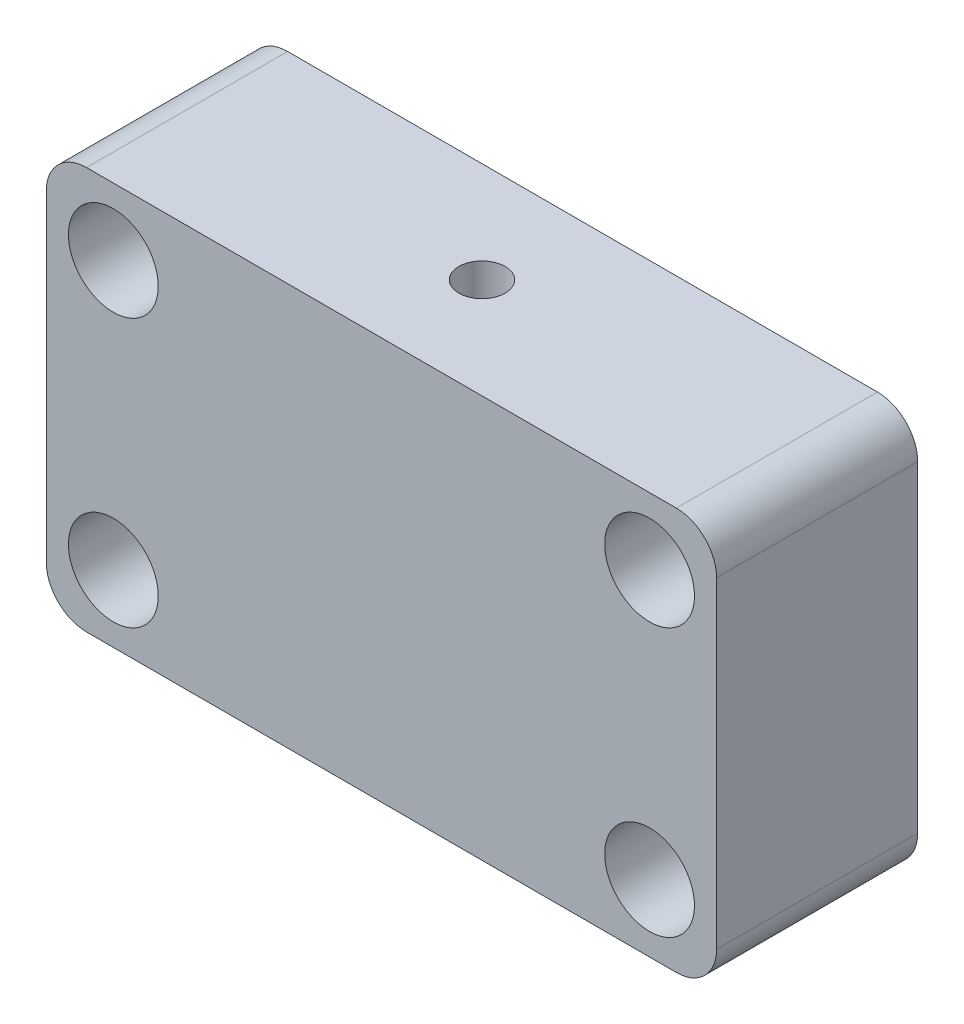
from build123d import *

# Parameters (mm, degrees)
SKETCH2_W                 = 50
SKETCH2_H                 = 30
SKETCH2_R                 = 3.35
BOSS_EXTRUDE1_DEPTH       = 15
F_8_32_TAPPED_HOLE1_D     = 3.4544
F_8_32_TAPPED_HOLE1_DEPTH = 5
F_8_32_TAPPED_HOLE1_TIP   = 1.037806461
FILLET1_R                 = 3
FILLET2_R                 = 3
FILLET3_R                 = 3
FILLET4_R                 = 3


with BuildPart() as part:
    # Sketch2 → Boss-Extrude1 (new body)
    with BuildSketch(Plane.XY):
        Rectangle(SKETCH2_W, SKETCH2_H)
        with Locations((20, 10)):
            Circle(SKETCH2_R, mode=Mode.SUBTRACT)
        with Locations((-20, 10)):
            Circle(SKETCH2_R, mode=Mode.SUBTRACT)
        with Locations((-20, -10)):
            Circle(SKETCH2_R, mode=Mode.SUBTRACT)
        with Locations((20, -10)):
            Circle(SKETCH2_R, mode=Mode.SUBTRACT)
    extrude(amount=BOSS_EXTRUDE1_DEPTH)

    # #8-32 Tapped Hole1
    with Locations(Plane(origin=(0, 15, 7.5), x_dir=(0, 0, 1), z_dir=(0, 1, 0))):
        with Locations((0, 0)):
            Hole(F_8_32_TAPPED_HOLE1_D / 2, depth=F_8_32_TAPPED_HOLE1_DEPTH)
            with Locations((0, 0, -(F_8_32_TAPPED_HOLE1_DEPTH + F_8_32_TAPPED_HOLE1_TIP / 2))):  # 118° drill point
                Cone(0, F_8_32_TAPPED_HOLE1_D / 2, F_8_32_TAPPED_HOLE1_TIP, mode=Mode.SUBTRACT)

    # Fillet1
    fillet1_edges = [part.edges().sort_by_distance(p)[0] for p in [
        (25, 15, 7.5),
    ]]
    fillet(fillet1_edges, radius=FILLET1_R)

    # Fillet2
    fillet2_edges = [part.edges().sort_by_distance(p)[0] for p in [
        (-25, 15, 7.5),
    ]]
    fillet(fillet2_edges, radius=FILLET2_R)

    # Fillet3
    fillet3_edges = [part.edges().sort_by_distance(p)[0] for p in [
        (25, -15, 7.5),
    ]]
    fillet(fillet3_edges, radius=FILLET3_R)

    # Fillet4
    fillet4_edges = [part.edges().sort_by_distance(p)[0] for p in [
        (-25, -15, 7.5),
    ]]
    fillet(fillet4_edges, radius=FILLET4_R)


solid = part.part
